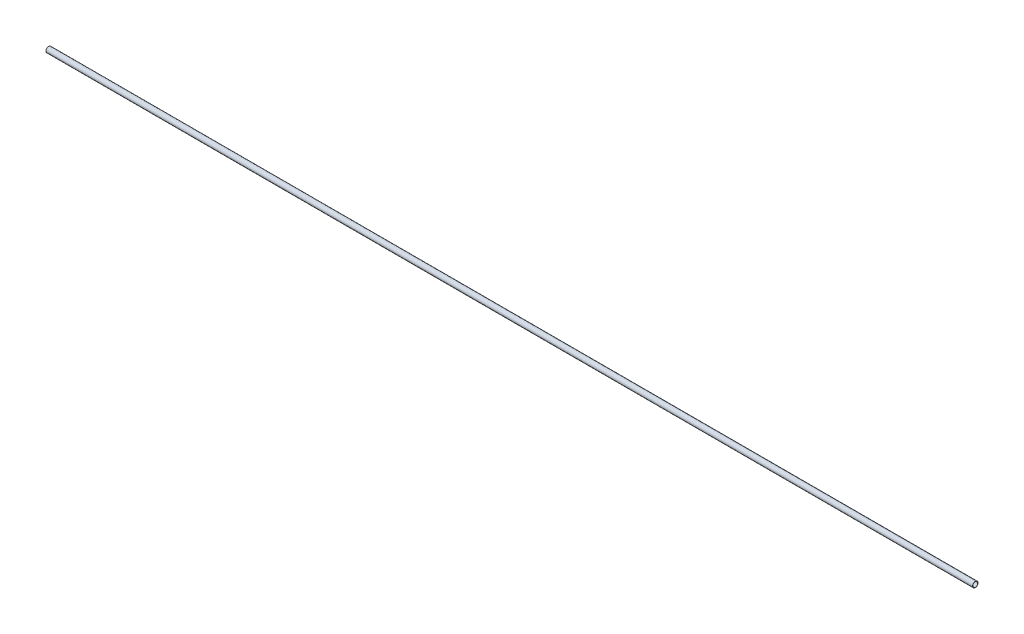
from build123d import *

# Parameters (mm, degrees)
SKETCH1_R           = 8.9662
SKETCH1_R_2         = 7.8994
BOSS_EXTRUDE1_DEPTH = 3048


with BuildPart() as part:
    # Sketch1 → Boss-Extrude1 (new body)
    with BuildSketch(Plane(origin=(0, 0, 0), x_dir=(0, 0, -1), z_dir=(1, 0, 0))):
        Circle(SKETCH1_R)
        Circle(SKETCH1_R_2, mode=Mode.SUBTRACT)
    extrude(amount=BOSS_EXTRUDE1_DEPTH)


solid = part.part
